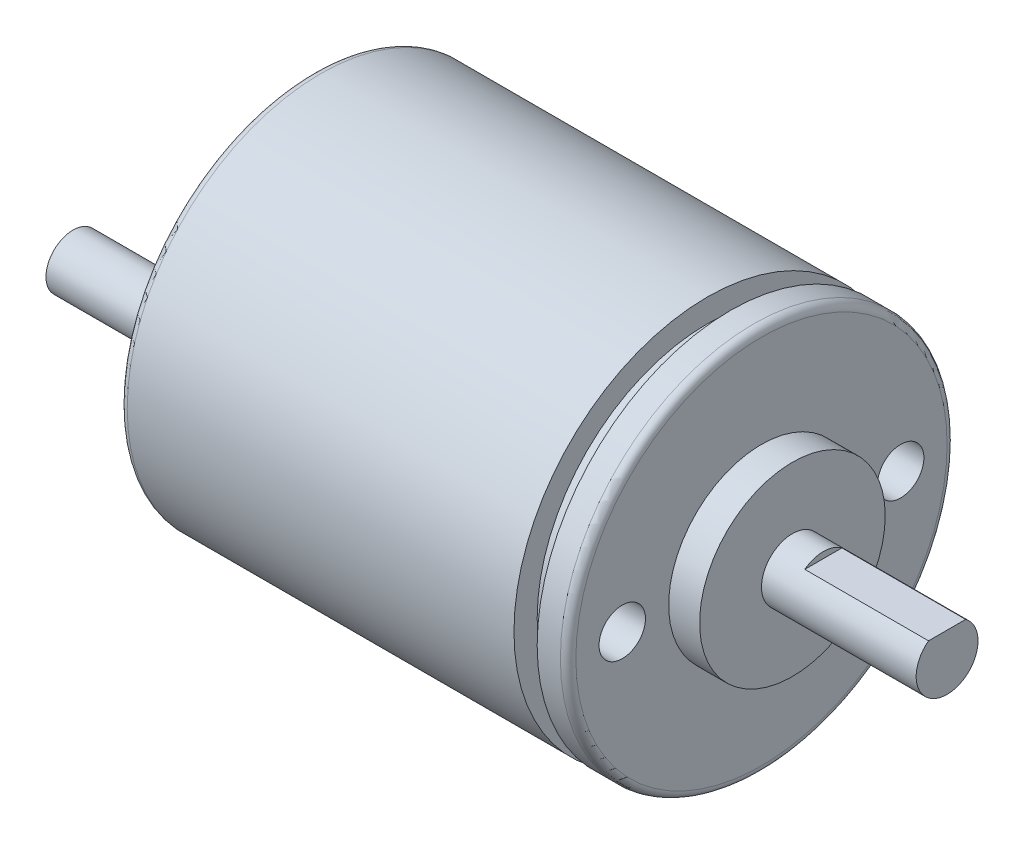
from build123d import *

# Parameters (mm, degrees)
SKETCH_1_R          = 12.5
EXTRUDE_1_DEPTH     = 29
CUT_EXTRUDE_START   = -1.5
SKETCH_2_R          = 12.5
SKETCH_2_R_2        = 11
CUT_EXTRUDE_1_DEPTH = 1.5
FILLET_1_R          = 0.5
SKETCH_3_R          = 6
EXTRUDE_2_DEPTH     = 2
SKETCH_4_R          = 2
EXTRUDE_3_DEPTH     = 10
CUT_EXTRUDE_START_2 = -8
CUT_EXTRUDE_2_DEPTH = 8
SKETCH_6_R          = 4
EXTRUDE_4_DEPTH     = 5.5
SKETCH_7_R          = 1.75
EXTRUDE_5_DEPTH     = 10
SKETCH_8_R          = 1.5
CUT_EXTRUDE_3_DEPTH = 4


with BuildPart() as part:
    # ｽｹｯﾁ1 → ﾎﾞｽ - 押し出し1 (new body)
    with BuildSketch(Plane(origin=(0, 0, 0), x_dir=(0, 0, -1), z_dir=(1, 0, 0))):
        with Locations(Location((0, 0, 0), (0, 0, 180))):
            Circle(SKETCH_1_R)
    extrude(amount=EXTRUDE_1_DEPTH)

    # ｽｹｯﾁ2 → ｶｯﾄ - 押し出し1 (cut)
    with BuildSketch(Plane(origin=(27, 0, 0), x_dir=(0, 0, -1), z_dir=(1, 0, 0)).offset(CUT_EXTRUDE_START)):
        with Locations(Location((0, 0, 0), (0, 0, 180))):
            Circle(SKETCH_2_R)
        Circle(SKETCH_2_R_2, mode=Mode.SUBTRACT)
    extrude(amount=CUT_EXTRUDE_1_DEPTH, mode=Mode.SUBTRACT)

    # ﾌｨﾚｯﾄ1
    fillet_1_edges = [part.edges().sort_by_distance(p)[0] for p in [
        (0, 0, -12.5),
        (29, 0, -12.5),
    ]]
    fillet(fillet_1_edges, radius=FILLET_1_R)

    # ｽｹｯﾁ3 → ﾎﾞｽ - 押し出し2 (add)
    with BuildSketch(Plane(origin=(29, 0, 0), x_dir=(0, 0, -1), z_dir=(1, 0, 0))):
        Circle(SKETCH_3_R)
    extrude(amount=EXTRUDE_2_DEPTH)

    # ｽｹｯﾁ4 → ﾎﾞｽ - 押し出し3 (add)
    with BuildSketch(Plane(origin=(31, 0, 0), x_dir=(0, 0, -1), z_dir=(1, 0, 0))):
        Circle(SKETCH_4_R)
    extrude(amount=EXTRUDE_3_DEPTH)

    # ｽｹｯﾁ5 → ｶｯﾄ - 押し出し2 (cut)
    with BuildSketch(Plane(origin=(41, 0, 0), x_dir=(0, 0, -1), z_dir=(1, 0, 0)).offset(CUT_EXTRUDE_START_2)):
        with BuildLine():
            Line((-1.2, 1.6), (1.2, 1.6))
            ThreePointArc((1.2, 1.6), (0, 2), (-1.2, 1.6))
        make_face()
    extrude(amount=CUT_EXTRUDE_2_DEPTH, mode=Mode.SUBTRACT)

    # ｽｹｯﾁ6 → ﾎﾞｽ - 押し出し4 (add)
    with BuildSketch(Plane.ZY):
        with Locations(Location((0, -6, 0), (0, 0, 180))):
            Circle(SKETCH_6_R)
    extrude(amount=EXTRUDE_4_DEPTH)

    # ｽｹｯﾁ7 → ﾎﾞｽ - 押し出し5 (add)
    with BuildSketch(Plane.ZY.offset(5.5)):
        with Locations((0, -6)):
            Circle(SKETCH_7_R)
    extrude(amount=EXTRUDE_5_DEPTH)

    # ｽｹｯﾁ8 → ｶｯﾄ - 押し出し3 (cut)
    with BuildSketch(Plane(origin=(29, 0, 0), x_dir=(0, 0, -1), z_dir=(1, 0, 0))):
        with Locations((-9, 0)):
            Circle(SKETCH_8_R)
        with Locations(Location((9, 0, 0), (0, 0, 180))):
            Circle(SKETCH_8_R)
    extrude(amount=-CUT_EXTRUDE_3_DEPTH, mode=Mode.SUBTRACT)


solid = part.part
